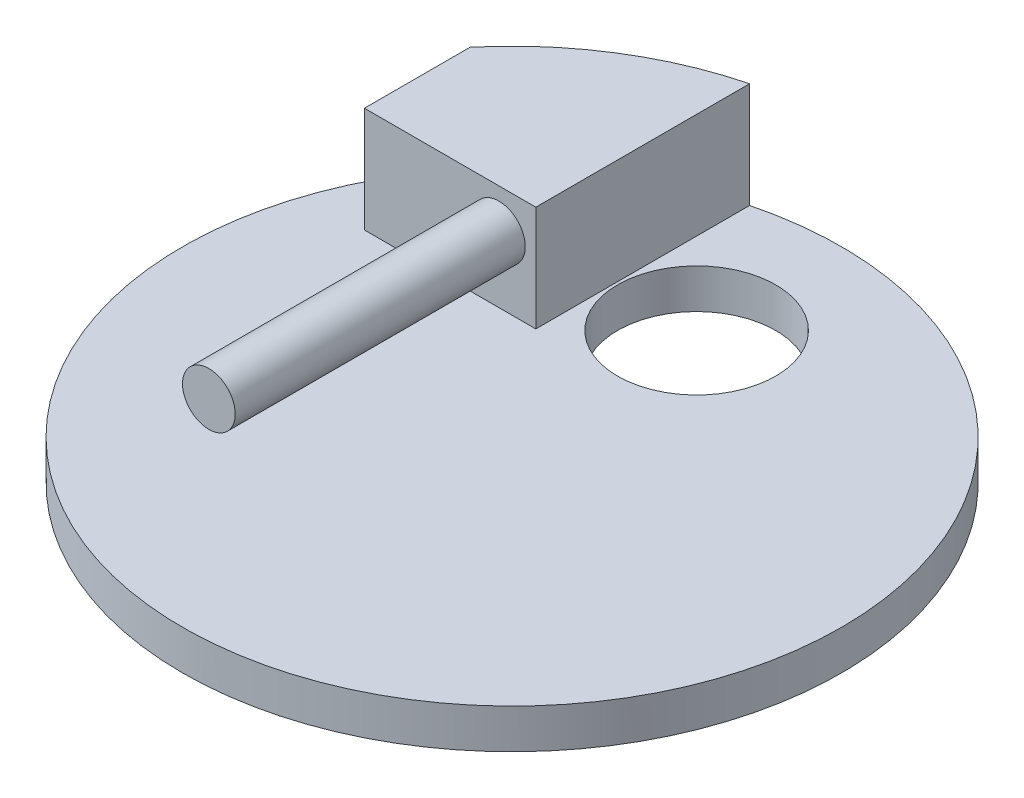
from build123d import *

# Parameters (mm, degrees)
SKETCH1_R                = 12.5
SKETCH1_R_2              = 3
BOSS_EXTRUDE1_DEPTH      = 1.5
SKETCH3_R                = 1
BOSS_EXTRUDE3_DEPTH      = 11
BOSS_EXTRUDE4_REACH      = 23.296
BOSS_EXTRUDE4_END_RADIUS = 12.5
SKETCH5_W                = 6.5
SKETCH5_H                = 4


with BuildPart() as part:
    # Sketch1 → Boss-Extrude1 (new body)
    with BuildSketch(Plane(origin=(0, 0, 0), x_dir=(1, 0, 0), z_dir=(0, 1, 0))):
        with Locations(Location((0, 0, 0), (0, 0, 270))):
            Circle(SKETCH1_R)
        with Locations(Location((0, 7, 0), (0, 0, 270))):
            Circle(SKETCH1_R_2, mode=Mode.SUBTRACT)
    extrude(amount=BOSS_EXTRUDE1_DEPTH)



with BuildPart() as body_2:
    # Sketch3 → Boss-Extrude3 (new body)
    with BuildSketch(Plane.XY.offset(-4)):
        with Locations((-4.5, 4)):
            Circle(SKETCH3_R)
    extrude(amount=BOSS_EXTRUDE3_DEPTH)


with BuildPart() as part_1:
    add(part.part)

    add(body_2.part)  # Boss-Extrude4 merges body 2
    # Boss-Extrude4: up to this cylinder (the profile starts inside it)
    boss_extrude4_end = Plane(origin=(0, 3.5, 0), z_dir=(0, -1, 0)) * Cylinder(BOSS_EXTRUDE4_END_RADIUS, 72.592, mode=Mode.PRIVATE)
    # Sketch5 → Boss-Extrude4 (add, up to the surface)
    with BuildSketch(Plane.XY.offset(-4), mode=Mode.PRIVATE) as boss_extrude4_sk1:
        with Locations((-6.35, 3.5)):
            Rectangle(SKETCH5_W, SKETCH5_H)
    boss_extrude4_tool1 = extrude(boss_extrude4_sk1.sketch, amount=-BOSS_EXTRUDE4_REACH, mode=Mode.PRIVATE) & boss_extrude4_end
    add(boss_extrude4_tool1.solids().sort_by_distance((-6.35, 3.5, -4))[0])


solid = part_1.part
